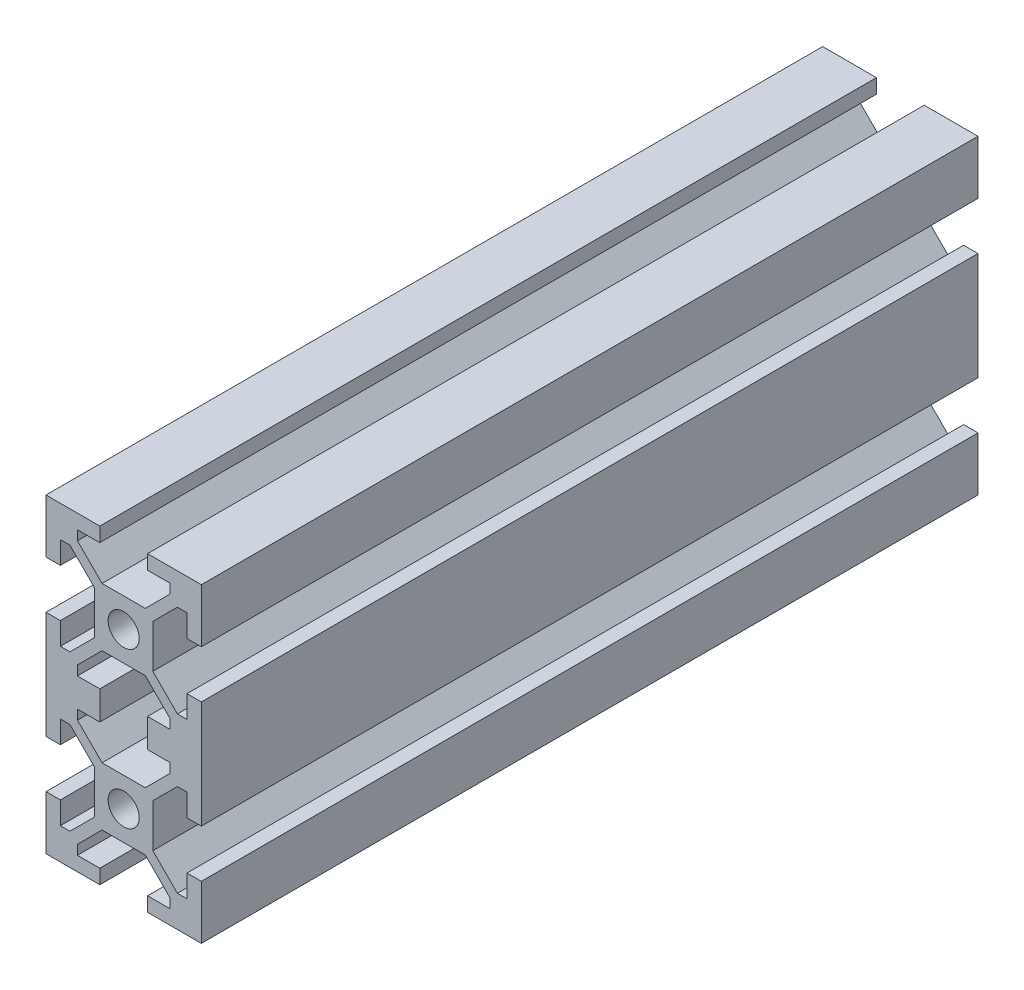
from build123d import *

# Parameters (mm, degrees)
SKETCH1_R           = 2
BOSS_EXTRUDE1_DEPTH = 100
LPATTERN1_COUNT     = 2
LPATTERN1_PITCH     = 20


with BuildPart() as part:
    # Sketch1 → Boss-Extrude1 (new body)
    with BuildSketch(Plane.XY):
        Polygon((-10, 3.075), (-8.15, 3.075), (-8.15, 5.95), (-6.91873629, 5.95), (-3.75, 2.78126371), (-3.75, 0), (-3.75, -2.78126371), (-6.91873629, -5.95), (-8.15, -5.95), (-8.15, -3.075), (-10, -3.075), (-10, -10), (-3.075, -10), (-3.075, -8.15), (-5.95, -8.15), (-5.95, -6.91873629), (-2.78126371, -3.75), (0, -3.75), (2.78126371, -3.75), (5.95, -6.91873629), (5.95, -8.15), (3.075, -8.15), (3.075, -10), (10, -10), (10, -3.075), (8.15, -3.075), (8.15, -5.95), (6.91873629, -5.95), (3.75, -2.78126371), (3.75, 0), (3.75, 2.78126371), (6.91873629, 5.95), (8.15, 5.95), (8.15, 3.075), (10, 3.075), (10, 10), (3.075, 10), (3.075, 8.15), (5.95, 8.15), (5.95, 6.91873629), (2.78126371, 3.75), (0, 3.75), (-2.78126371, 3.75), (-5.95, 6.91873629), (-5.95, 8.15), (-3.075, 8.15), (-3.075, 10), (-10, 10), align=None)
        Circle(SKETCH1_R, mode=Mode.SUBTRACT)
    boss_extrude1 = extrude(amount=BOSS_EXTRUDE1_DEPTH)

    # LPattern1: Boss-Extrude1 ×2
    with Locations(*[(0, i * LPATTERN1_PITCH, 0) for i in range(1, LPATTERN1_COUNT)]):
        add(boss_extrude1)


solid = part.part
